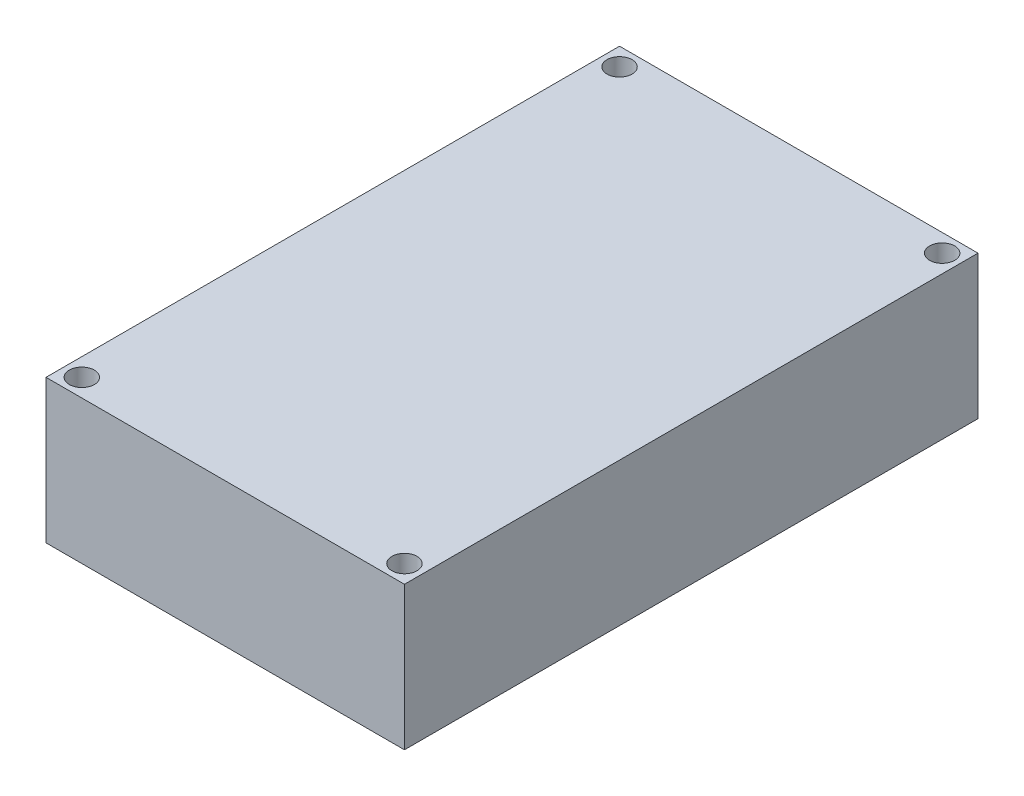
from build123d import *

# Parameters (mm, degrees)
SKETCH1_W           = 50
SKETCH1_H           = 80
SKETCH1_R           = 1.75
BOSS_EXTRUDE1_DEPTH = 20


with BuildPart() as part:
    # Sketch1 → Boss-Extrude1 (new body)
    with BuildSketch(Plane(origin=(0, 0, 0), x_dir=(1, 0, 0), z_dir=(0, 1, 0))):
        with Locations((18.440633245, -17.103166227)):
            Rectangle(SKETCH1_W, SKETCH1_H)
        with Locations(Location((40.940633245, 20.396833773, 0), (0, 0, 270))):
            Circle(SKETCH1_R, mode=Mode.SUBTRACT)
        with Locations(Location((-4.059366755, 20.396833773, 0), (0, 0, 270))):
            Circle(SKETCH1_R, mode=Mode.SUBTRACT)
        with Locations(Location((-4.059366755, -54.603166227, 0), (0, 0, 270))):
            Circle(SKETCH1_R, mode=Mode.SUBTRACT)
        with Locations(Location((40.940633245, -54.603166227, 0), (0, 0, 270))):
            Circle(SKETCH1_R, mode=Mode.SUBTRACT)
    extrude(amount=BOSS_EXTRUDE1_DEPTH)


solid = part.part
